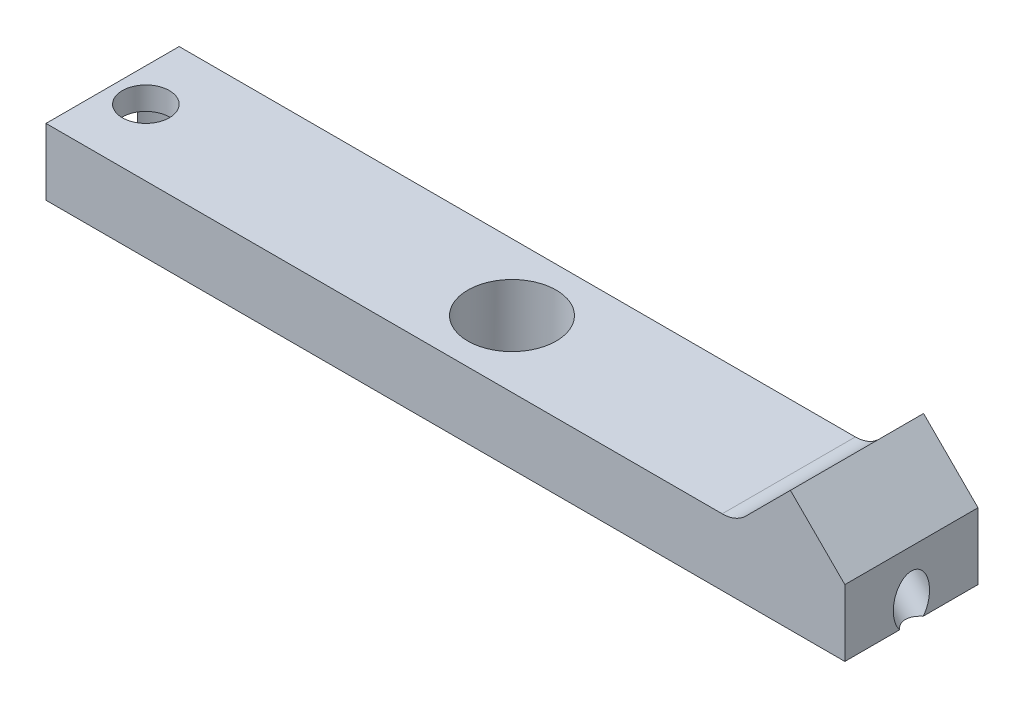
from build123d import *

# Parameters (mm, degrees)
SKETCH1_W                                      = 76.2
SKETCH1_H                                      = 12.7
BOSS_EXTRUDE1_DEPTH                            = 3.175
F_5_16_CLEARANCE_HOLE1_D                       = 8.4328
F_5_16_CLEARANCE_HOLE1_DEPTH                   = 16.51
F_5_16_CLEARANCE_HOLE1_TIP                     = 2.533468714
BOSS_EXTRUDE2_DEPTH                            = 6.35
CBORE_FOR_8_SOCKET_HEAD_CAP_SCREW1_D           = 4.4958
CBORE_FOR_8_SOCKET_HEAD_CAP_SCREW1_DEPTH       = 16.51
CBORE_FOR_8_SOCKET_HEAD_CAP_SCREW1_CBORE_D     = 7.9375
CBORE_FOR_8_SOCKET_HEAD_CAP_SCREW1_CBORE_DEPTH = 4.1656
CBORE_FOR_8_SOCKET_HEAD_CAP_SCREW1_TIP         = 1.350674586
F_8_32_TAPPED_HOLE1_D                          = 3.4544
FILLET1_R                                      = 3.175


with BuildPart() as part:
    # Sketch1 → Boss-Extrude1 (new, symmetric)
    with BuildSketch(Plane(origin=(0, 0, 0), x_dir=(1, 0, 0), z_dir=(0, 1, 0))):
        Rectangle(SKETCH1_W, SKETCH1_H)
    extrude(amount=BOSS_EXTRUDE1_DEPTH, both=True)

    # 5/16 Clearance Hole1
    with Locations(Plane(origin=(0, 3.175, 0), x_dir=(1, 0, 0), z_dir=(0, 1, 0))):
        with Locations((0, 0)):
            Hole(F_5_16_CLEARANCE_HOLE1_D / 2, depth=F_5_16_CLEARANCE_HOLE1_DEPTH)
            with Locations((0, 0, -(F_5_16_CLEARANCE_HOLE1_DEPTH + F_5_16_CLEARANCE_HOLE1_TIP / 2))):  # 118° drill point
                Cone(0, F_5_16_CLEARANCE_HOLE1_D / 2, F_5_16_CLEARANCE_HOLE1_TIP, mode=Mode.SUBTRACT)

    # Sketch6 → Boss-Extrude2 (add, symmetric)
    with BuildSketch(Plane.XY):
        Polygon((38.1, 3.175), (32.907844009, 8.367155991), (27.715688019, 3.175), align=None)
    extrude(amount=BOSS_EXTRUDE2_DEPTH, both=True)

    # CBORE for #8 Socket Head Cap Screw1
    with Locations(Plane(origin=(0, -3.175, 0), x_dir=(-1, 0, 0), z_dir=(0, -1, 0))):
        with Locations((34.925, 0)):
            CounterBoreHole(CBORE_FOR_8_SOCKET_HEAD_CAP_SCREW1_D / 2, CBORE_FOR_8_SOCKET_HEAD_CAP_SCREW1_CBORE_D / 2, CBORE_FOR_8_SOCKET_HEAD_CAP_SCREW1_CBORE_DEPTH, depth=CBORE_FOR_8_SOCKET_HEAD_CAP_SCREW1_DEPTH)
            with Locations((0, 0, -(CBORE_FOR_8_SOCKET_HEAD_CAP_SCREW1_DEPTH + CBORE_FOR_8_SOCKET_HEAD_CAP_SCREW1_TIP / 2))):  # 118° drill point
                Cone(0, CBORE_FOR_8_SOCKET_HEAD_CAP_SCREW1_D / 2, CBORE_FOR_8_SOCKET_HEAD_CAP_SCREW1_TIP, mode=Mode.SUBTRACT)

    # #8-32 Tapped Hole1 (through all)
    with Locations(Plane(origin=(12.270344009, -12.270344009, 0), x_dir=(0.7071067811865476, 0.7071067811865475, 0), z_dir=(-0.7071067811865475, 0.7071067811865476, 0))):
        with Locations((26.010832393, 0)):
            Hole(F_8_32_TAPPED_HOLE1_D / 2)

    # Fillet1
    fillet1_edges = [part.edges().sort_by_distance(p)[0] for p in [
        (27.715688019, 3.175, 0),
    ]]
    fillet(fillet1_edges, radius=FILLET1_R)


solid = part.part
